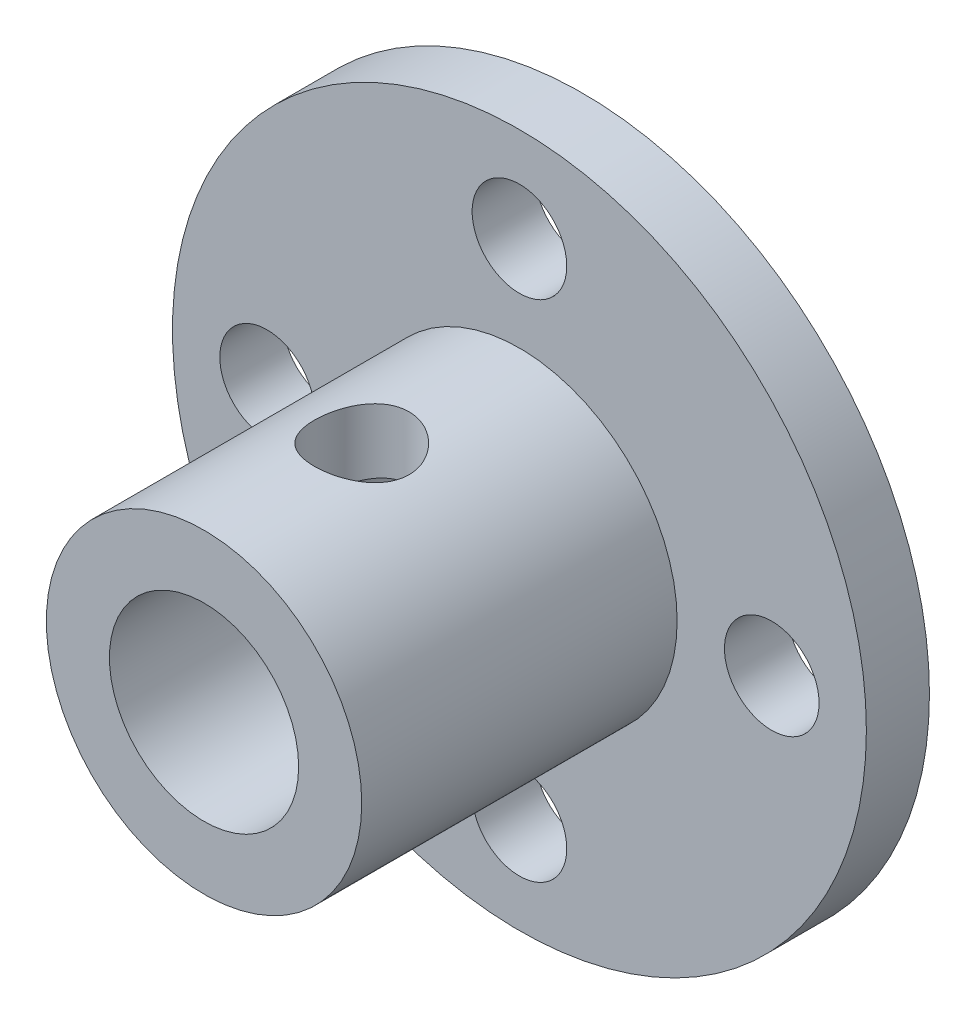
from build123d import *

# Parameters (mm, degrees)
CROQUIS1_R              = 11
SALIENTE_EXTRUIR1_DEPTH = 2
CROQUIS2_R              = 5
CROQUIS2_R_2            = 3
SALIENTE_EXTRUIR2_DEPTH = 10
CORTAR_EXTRUIR1_START   = -10
CROQUIS3_R              = 1.5
CROQUIS3_R_2            = 3
CORTAR_EXTRUIR1_DEPTH   = 10
CROQUIS4_R              = 1.5
CORTAR_EXTRUIR2_DEPTH   = 5


with BuildPart() as part:
    # Croquis1 → Saliente-Extruir1 (new body)
    with BuildSketch(Plane.XY):
        Circle(CROQUIS1_R)
    extrude(amount=SALIENTE_EXTRUIR1_DEPTH)

    # Croquis2 → Saliente-Extruir2 (add)
    with BuildSketch(Plane.XY.offset(2)):
        Circle(CROQUIS2_R)
        Circle(CROQUIS2_R_2, mode=Mode.SUBTRACT)
    extrude(amount=SALIENTE_EXTRUIR2_DEPTH)

    # Croquis3 → Cortar-Extruir1 (cut)
    with BuildSketch(Plane.XY.offset(2).offset(CORTAR_EXTRUIR1_START)):
        with Locations((-8, 0)):
            Circle(CROQUIS3_R)
        with Locations((0, 8)):
            Circle(CROQUIS3_R)
        with Locations((8, 0)):
            Circle(CROQUIS3_R)
        with Locations((0, -8)):
            Circle(CROQUIS3_R)
        Circle(CROQUIS3_R_2)
    extrude(amount=CORTAR_EXTRUIR1_DEPTH, mode=Mode.SUBTRACT)

    # Croquis4 → Cortar-Extruir2 (cut, symmetric)
    with BuildSketch(Plane(origin=(0, 0, 0), x_dir=(1, 0, 0), z_dir=(0, 1, 0))):
        with Locations(Location((0, -7, 0), (0, 0, 270))):
            Circle(CROQUIS4_R)
    extrude(amount=CORTAR_EXTRUIR2_DEPTH, both=True, mode=Mode.SUBTRACT)


solid = part.part
